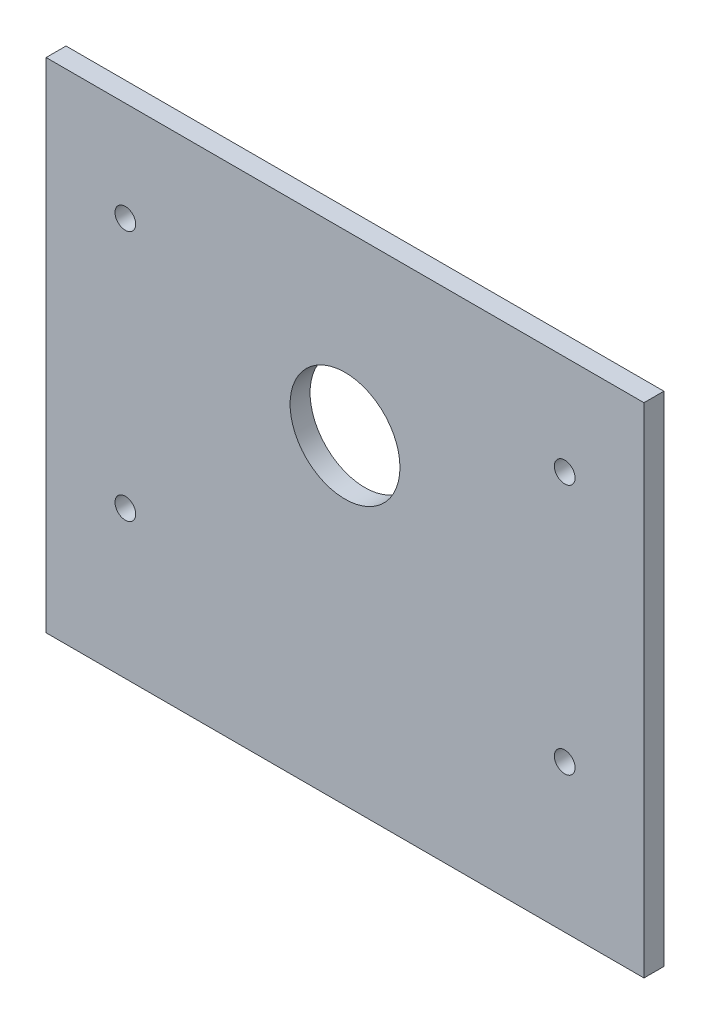
from build123d import *

# Parameters (mm, degrees)
SKETCH1_W           = 76.2
SKETCH1_H           = 63.5
SKETCH1_R           = 1.3208
SKETCH1_R_2         = 7
BOSS_EXTRUDE1_DEPTH = 2.54


with BuildPart() as part:
    # Sketch1 → Boss-Extrude1 (new body)
    with BuildSketch(Plane.XY):
        Rectangle(SKETCH1_W, SKETCH1_H)
        with Locations((-28, 19.05)):
            Circle(SKETCH1_R, mode=Mode.SUBTRACT)
        with Locations((28, 19.05)):
            Circle(SKETCH1_R, mode=Mode.SUBTRACT)
        with Locations((-28, -12.95)):
            Circle(SKETCH1_R, mode=Mode.SUBTRACT)
        with Locations((28, -12.95)):
            Circle(SKETCH1_R, mode=Mode.SUBTRACT)
        with Locations((0, 9.05)):
            Circle(SKETCH1_R_2, mode=Mode.SUBTRACT)
    extrude(amount=-BOSS_EXTRUDE1_DEPTH)


solid = part.part
